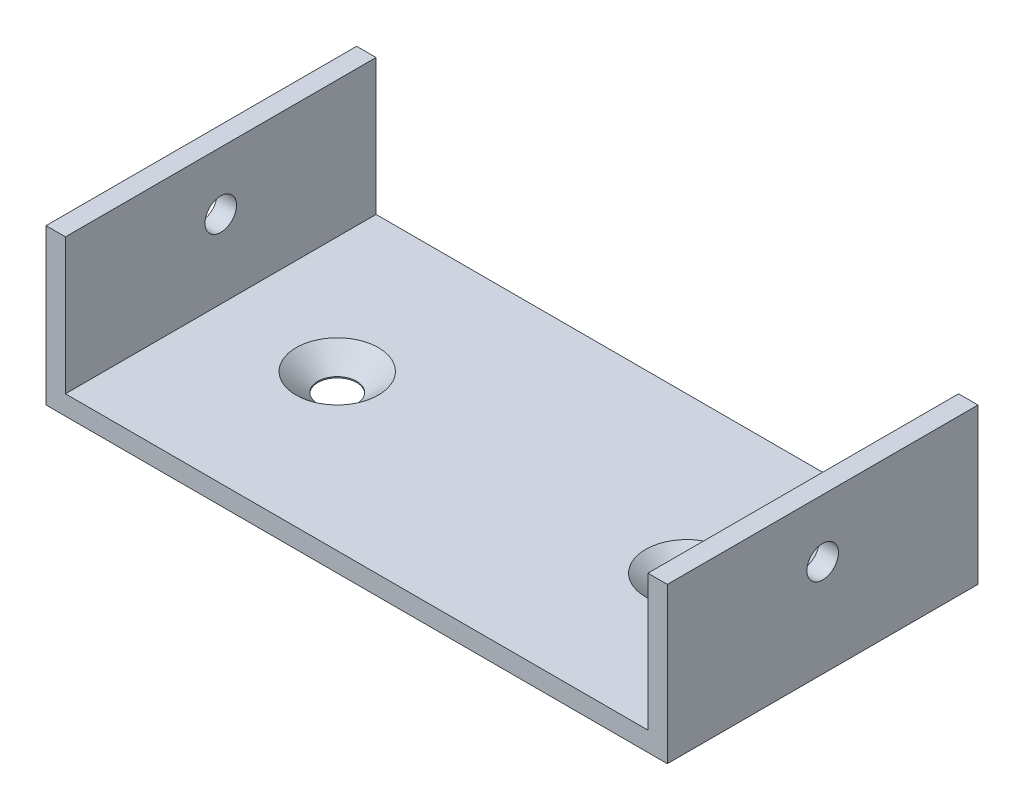
from build123d import *

# Parameters (mm, degrees)
BOSS_EXTRUDE2_DEPTH                  = 25.4
F_1_4_0_25_DIAMETER_HOLE1_AT_2_COUNT = 2
F_1_4_0_25_DIAMETER_HOLE1_AT_2_PITCH = 57.15
F_13_64_0_20313_DIAMETER_HOLE1_D     = 5.159502


with BuildPart() as part:
    # Sketch3 → Boss-Extrude2 (new, symmetric)
    with BuildSketch(Plane.XY):
        Polygon((-50.8, 12.7), (-50.8, -12.7), (50.8, -12.7), (50.8, 12.7), (47.625, 12.7), (47.625, -9.525), (-47.625, -9.525), (-47.625, 12.7), align=None)
    extrude(amount=BOSS_EXTRUDE2_DEPTH, both=True)

    # Sketch6 → 1/4 (0.25) Diameter Hole1 (revolve, cut)
    with BuildSketch(Plane(origin=(-28.575, -9.525, 0), x_dir=(0, 0, 1), z_dir=(1, 0, 0))):
        Polygon((0, 0), (0, 3.175), (3.175, 3.175), (3.175, 2.983838288), (6.731, 0), align=None)
    f_1_4_0_25_diameter_hole1 = revolve(axis=Axis((-28.575, -3.175, 0), (0, -1, 0)), mode=Mode.SUBTRACT)

    # 1/4 (0.25) Diameter Hole1 at 2: 1/4 (0.25) Diameter Hole1 ×2
    with Locations(*[(i * F_1_4_0_25_DIAMETER_HOLE1_AT_2_PITCH, 0, 0) for i in range(1, F_1_4_0_25_DIAMETER_HOLE1_AT_2_COUNT)]):
        add(f_1_4_0_25_diameter_hole1, mode=Mode.SUBTRACT)

    # 13/64 (0.20313) Diameter Hole1 (through all)
    with Locations(Plane(origin=(50.8, 0, 0), x_dir=(0, 0, -1), z_dir=(1, 0, 0))):
        with Locations((0, 3.215843377)):
            Hole(F_13_64_0_20313_DIAMETER_HOLE1_D / 2)


solid = part.part
